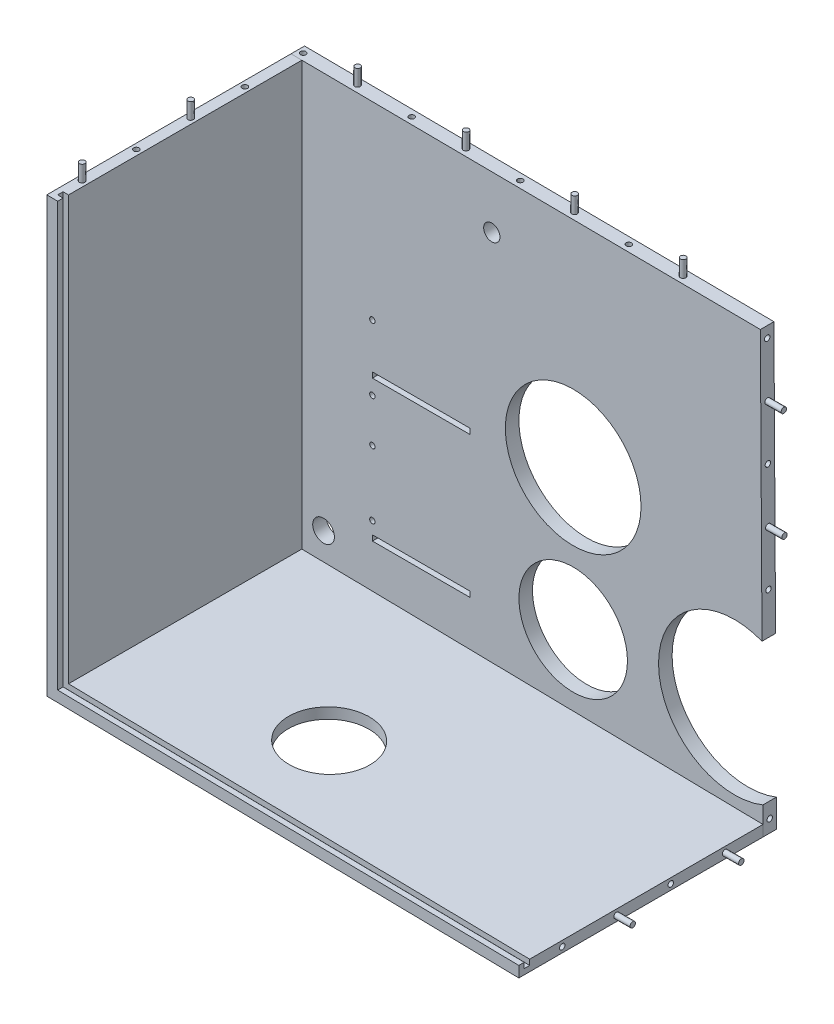
from build123d import *

# Parameters (mm, degrees)
SALIENTE_EXTRUIR1_DEPTH = 2.5
SALIENTE_EXTRUIR2_DEPTH = 45
CROQUIS17_R             = 12.5
CROQUIS17_R_2           = 10
CROQUIS17_R_3           = 2
CROQUIS17_R_4           = 0.5
CROQUIS17_R_5           = 1.5
CROQUIS17_W             = 18
CROQUIS17_H             = 1
CORTAR_EXTRUIR1_DEPTH   = 45
CROQUIS18_W             = 1
CROQUIS18_H             = 78.017022252
CORTAR_EXTRUIR2_DEPTH   = 1
CROQUIS19_W             = 1
CROQUIS19_H             = 1
CORTAR_EXTRUIR3_DEPTH   = 1
CROQUIS20_W             = 1
CROQUIS20_H             = 1
CORTAR_EXTRUIR4_DEPTH   = 1
CORTAR_EXTRUIR5_DEPTH   = 1
CROQUIS24_R             = 0.5
CORTAR_EXTRUIR13_DEPTH  = 4
CROQUIS25_R             = 0.5
SALIENTE_EXTRUIR3_DEPTH = 3
CROQUIS26_R             = 0.5
SALIENTE_EXTRUIR4_DEPTH = 3
CROQUIS27_R             = 0.5
CORTAR_EXTRUIR14_DEPTH  = 4
CROQUIS28_R             = 7.5
CORTAR_EXTRUIR15_DEPTH  = 45
CORTAR_EXTRUIR16_DEPTH  = 1
CROQUIS30_R             = 0.5
CORTAR_EXTRUIR17_DEPTH  = 4
CROQUIS31_R             = 0.5
SALIENTE_EXTRUIR5_DEPTH = 3
CROQUIS32_R             = 0.5
CORTAR_EXTRUIR18_DEPTH  = 4
CROQUIS33_R             = 0.5
SALIENTE_EXTRUIR6_DEPTH = 3


with BuildPart() as part:
    # Croquis15 → Saliente-Extruir1 (new body)
    with BuildSketch(Plane.XY):
        Polygon((0.493585448, -0.747010607), (-86, 0), (-86, -80), (0.987170897, -81.494021214), align=None)
    extrude(amount=SALIENTE_EXTRUIR1_DEPTH)

    # Croquis16 → Saliente-Extruir2 (add)
    with BuildSketch(Plane.XY.offset(2.5)):
        Polygon((-84, -0.017027708), (-84, -78.034055415), (0.974771701, -79.49351329), (0.987170897, -81.494021214), (-86, -80), (-86, 0), align=None)
    extrude(amount=SALIENTE_EXTRUIR2_DEPTH)

    # Croquis17 → Cortar-Extruir1 (cut)
    with BuildSketch(Plane.XY.offset(2.5)):
        with Locations((-34, -40)):
            Circle(CROQUIS17_R)
        with Locations((-34, -65.890897655)):
            Circle(CROQUIS17_R_2)
        with Locations((-80, -73.102018763)):
            Circle(CROQUIS17_R_3)
        with Locations((-71, -67)):
            Circle(CROQUIS17_R_4)
        with Locations((-71, -55)):
            Circle(CROQUIS17_R_4)
        with Locations((-71, -47)):
            Circle(CROQUIS17_R_4)
        with Locations((-71, -35)):
            Circle(CROQUIS17_R_4)
        with Locations((-49, -10)):
            Circle(CROQUIS17_R_5)
        with BuildLine():
            Line((0.796795552, -50.349991207), (0.955966786, -76.389254287))
            ThreePointArc((0.955966786, -76.389254287), (-18.269411222, -63.48665599), (0.796795552, -50.349991207))
        make_face()
        with Locations((-62, -43.756153027)):
            Rectangle(CROQUIS17_W, CROQUIS17_H)
        with Locations((-62, -69.756153027)):
            Rectangle(CROQUIS17_W, CROQUIS17_H)
    extrude(amount=-CORTAR_EXTRUIR1_DEPTH, mode=Mode.SUBTRACT)

    # Croquis18 → Cortar-Extruir2 (cut)
    with BuildSketch(Plane(origin=(-84, 0, 0), x_dir=(0, 0, -1), z_dir=(1, 0, 0))):
        with Locations((-46, -39.025544289)):
            Rectangle(CROQUIS18_W, CROQUIS18_H)
    extrude(amount=-CORTAR_EXTRUIR2_DEPTH, mode=Mode.SUBTRACT)

    # Croquis19 → Cortar-Extruir3 (cut)
    with BuildSketch(Plane(origin=(-0.006233319, -0.732138357, 0), x_dir=(0.9999637591169493, -0.008513545248592774, 0), z_dir=(0.008513545248592772, 0.9999637591169492, 0))):
        with Locations((-84.496810753, -46)):
            Rectangle(CROQUIS19_W, CROQUIS19_H)
    extrude(amount=-CORTAR_EXTRUIR3_DEPTH, mode=Mode.SUBTRACT)

    # Croquis20 → Cortar-Extruir4 (cut)
    with BuildSketch(Plane(origin=(0, -78.034055415, 0), x_dir=(1, 0, 0), z_dir=(0, 1, 0))):
        with Locations((-84.5, -46)):
            Rectangle(CROQUIS20_W, CROQUIS20_H)
    extrude(amount=-CORTAR_EXTRUIR4_DEPTH, mode=Mode.SUBTRACT)

    # Croquis21 → Cortar-Extruir5 (cut)
    with BuildSketch(Plane(origin=(-1.364626126, -79.453333687, 0), x_dir=(0.9998525390425657, -0.017172657631677066, 0), z_dir=(0.017172657631677066, 0.9998525390425657, 0))):
        Polygon((-82.647561162, -45.5), (2.339744744, -45.5), (2.893712102, -45.5), (2.893712102, -46.5), (2.339744744, -46.5), (-82.647561162, -46.5), align=None)
    extrude(amount=-CORTAR_EXTRUIR5_DEPTH, mode=Mode.SUBTRACT)

    # Croquis24 → Cortar-Extruir13 (cut)
    with BuildSketch(Plane(origin=(0.489000895, 0.002989135, 0), x_dir=(0, 0, -1), z_dir=(0.9999813177309185, 0.006112625388175005, 0))):
        with Locations(Location((-1.25, -79.193670629, 0), (0, 0, 90))):
            Circle(CROQUIS24_R)
        with Locations(Location((-1.25, -2.750013754, 0), (0, 0, 90))):
            Circle(CROQUIS24_R)
        with Locations(Location((-1.25, -22.750013754, 0), (0, 0, 90))):
            Circle(CROQUIS24_R)
        with Locations(Location((-1.25, -42.750013754, 0), (0, 0, 90))):
            Circle(CROQUIS24_R)
    extrude(amount=-CORTAR_EXTRUIR13_DEPTH, mode=Mode.SUBTRACT)

    # Croquis25 → Saliente-Extruir3 (add)
    with BuildSketch(Plane(origin=(0.489000895, 0.002989135, 0), x_dir=(0, 0, -1), z_dir=(0.9999813177309185, 0.006112625388175005, 0))):
        with Locations(Location((-1.25, -12.750013754, 0), (0, 0, 270))):
            Circle(CROQUIS25_R)
        with Locations(Location((-1.25, -32.750013754, 0), (0, 0, 270))):
            Circle(CROQUIS25_R)
    extrude(amount=SALIENTE_EXTRUIR3_DEPTH)

    # Croquis26 → Saliente-Extruir4 (add)
    with BuildSketch(Plane(origin=(0.482050481, 0.00298776, 0), x_dir=(0, 0, -1), z_dir=(0.9999807928027947, 0.006197904927802061, 0))):
        with Locations(Location((-29.5, -80.498301159, 0), (0, 0, 270))):
            Circle(CROQUIS26_R)
        with Locations(Location((-9.5, -80.498301159, 0), (0, 0, 270))):
            Circle(CROQUIS26_R)
    extrude(amount=SALIENTE_EXTRUIR4_DEPTH)

    # Croquis27 → Cortar-Extruir14 (cut)
    with BuildSketch(Plane(origin=(0.482050481, 0.00298776, 0), x_dir=(0, 0, -1), z_dir=(0.9999807928027947, 0.006197904927802061, 0))):
        with Locations(Location((-39.5, -80.498301159, 0), (0, 0, 90))):
            Circle(CROQUIS27_R)
        with Locations(Location((-19.5, -80.498301159, 0), (0, 0, 90))):
            Circle(CROQUIS27_R)
    extrude(amount=-CORTAR_EXTRUIR14_DEPTH, mode=Mode.SUBTRACT)

    # Croquis28 → Cortar-Extruir15 (cut)
    with BuildSketch(Plane(origin=(-1.398971441, -81.453038765, 0), x_dir=(0.9998525390425657, -0.017172657631677253, 0), z_dir=(-0.017172657631677253, -0.9998525390425657, 0))):
        with Locations((-50.113505747, 30)):
            Circle(CROQUIS28_R)
    extrude(amount=-CORTAR_EXTRUIR15_DEPTH, mode=Mode.SUBTRACT)

    # Croquis29 → Cortar-Extruir16 (cut)
    # profile 1 of 3: a face of its own
    with BuildSketch(Plane.ZY.offset(86)):
        with BuildLine():
            Line((35.52329541, -9.711538462), (35.52329541, -13.237179487))
            Line((35.52329541, -13.237179487), (20.429144769, -13.237179487))
            add(Edge.make_bspline(
                [(20.429144769, -13.237179487), (20.22047782, -13.236841737), (19.824837832, -13.23620135), (19.263896049, -13.240457868), (18.766476045, -13.252080365), (18.330708278, -13.260554583), (17.958236379, -13.273898403), (17.649661698, -13.296236406), (17.403575485, -13.312271777), (17.260662882, -13.33327988), (17.198976499, -13.342347756)],
                knots=[0, 0, 0, 0, 1.548615846, 2.93623095, 4.162984955, 5.241106349, 6.171018895, 6.928366462, 7.537443197, 8, 8, 8, 8], degree=3))
            add(Edge.make_bspline(
                [(17.198976499, -13.342347756), (16.96412934, -13.382077135), (16.513602756, -13.458293262), (15.879401974, -13.654086173), (15.320211591, -13.916571317), (14.819510023, -14.234178966), (14.386167329, -14.639811945), (13.992100598, -15.120178679), (13.642365687, -15.692786222), (13.340195558, -16.339291023), (13.090005597, -17.026900065), (12.901019793, -17.728129376), (12.78650359, -18.431694824), (12.773400723, -18.902503101), (12.766885153, -19.13661859)],
                knots=[0, 0, 0, 0, 1.067590609, 2.048046695, 2.965859215, 3.831907952, 4.695720383, 5.616094925, 6.611391988, 7.696587727, 8.812250663, 9.889278634, 10.950416576, 12, 12, 12, 12], degree=3))
            add(Edge.make_bspline(
                [(12.766885153, -19.13661859), (12.771984899, -19.354033868), (12.782116792, -19.785982571), (12.884189597, -20.423969754), (13.031967772, -21.050655641), (13.246142555, -21.656380321), (13.51653777, -22.227854792), (13.823959056, -22.760115625), (14.190892209, -23.233189992), (14.595330176, -23.66153837), (15.050100538, -24.037142647), (15.557209831, -24.349999074), (16.102651414, -24.626753304), (16.494244363, -24.758696274), (16.693167205, -24.825721154)],
                knots=[0, 0, 0, 0, 1.053587853, 2.093210329, 3.126064893, 4.1733194, 5.20188158, 6.189084004, 7.14768823, 8.09825903, 9.041562098, 9.998421197, 10.983230561, 12, 12, 12, 12], degree=3))
            add(Edge.make_bspline(
                [(16.693167205, -24.825721154), (16.778007387, -24.848727684), (16.964351604, -24.899259562), (17.279546355, -24.951579566), (17.655541864, -24.996027767), (18.093493353, -25.028355568), (18.590989912, -25.05806358), (19.14847833, -25.085705063), (19.7680829, -25.091593312), (20.202120744, -25.094587653), (20.429144769, -25.096153846)],
                knots=[0, 0, 0, 0, 0.561597947, 1.23350194, 2.039532505, 2.981504442, 4.039824342, 5.225453205, 6.548769908, 8, 8, 8, 8], degree=3))
            Line((20.429144769, -25.096153846), (35.52329541, -25.096153846))
            Line((35.52329541, -25.096153846), (35.52329541, -28.621794872))
            Line((35.52329541, -28.621794872), (20.479224897, -28.621794872))
            add(Edge.make_bspline(
                [(20.479224897, -28.621794872), (20.21375126, -28.620453864), (19.694242623, -28.617829629), (18.934447131, -28.58038573), (18.212556526, -28.527948127), (17.529078376, -28.448042871), (16.882841755, -28.342180266), (16.272707641, -28.21825022), (15.698637804, -28.073782209), (15.157290018, -27.903124304), (14.63991941, -27.699018156), (14.145396187, -27.438871772), (13.665559902, -27.132905857), (13.196849632, -26.781295749), (12.7459689, -26.376455058), (12.303788081, -25.927975482), (11.886299412, -25.421587843), (11.473265962, -24.882050562), (11.100725204, -24.294361259), (10.774191226, -23.671274939), (10.496894262, -23.016621485), (10.273579012, -22.330844799), (10.095746711, -21.613085652), (9.973729713, -20.864405333), (9.895727902, -20.083115391), (9.886815203, -19.552475038), (9.882269769, -19.281850962)],
                knots=[0, 0, 0, 0, 1.184156262, 2.317290007, 3.392772778, 4.412540671, 5.385841058, 6.313246062, 7.18923477, 8.02531694, 8.843971838, 9.66668118, 10.513702469, 11.380526931, 12.277256598, 13.214624232, 14.187183621, 15.202946586, 16.244160134, 17.286757567, 18.33793663, 19.411793888, 20.500906476, 21.633354837, 22.79302213, 24, 24, 24, 24], degree=3))
            add(Edge.make_bspline(
                [(9.882269769, -19.281850962), (9.887812324, -19.004635112), (9.898679014, -18.461127982), (9.962542537, -17.65951378), (10.078589861, -16.888661781), (10.237154038, -16.147021382), (10.444409043, -15.436225971), (10.693863718, -14.754501859), (10.990134404, -14.101619394), (11.32925914, -13.481705678), (11.70859858, -12.902952526), (12.119616123, -12.369599752), (12.563317193, -11.885173186), (13.036654256, -11.449844297), (13.543198032, -11.067277308), (14.074134589, -10.72730477), (14.642524512, -10.448001887), (15.037596556, -10.297749357), (15.235835474, -10.222355769)],
                knots=[0, 0, 0, 0, 1.183856505, 2.321059394, 3.431013839, 4.51040075, 5.557140175, 6.590049844, 7.607719453, 8.615832089, 9.604399492, 10.559715878, 11.48805571, 12.406324034, 13.301673357, 14.195574285, 15.094576781, 16, 16, 16, 16], degree=3))
            add(Edge.make_bspline(
                [(15.235835474, -10.222355769), (15.370526633, -10.180383198), (15.660336611, -10.090072371), (16.137751847, -9.987545784), (16.686939012, -9.906402917), (17.306037885, -9.828917183), (17.998041842, -9.777922297), (18.761002453, -9.735903387), (19.596085928, -9.719763974), (20.177076008, -9.714352661), (20.479224897, -9.711538462)],
                knots=[0, 0, 0, 0, 0.640185946, 1.377464392, 2.213439944, 3.159948418, 4.209014146, 5.362447644, 6.628318208, 8, 8, 8, 8], degree=3))
            Line((20.479224897, -9.711538462), (35.52329541, -9.711538462))
        make_face()
    # profile 2 of 3: a face of its own
    with BuildSketch(Plane.ZY.offset(86)):
        with BuildLine():
            Line((15.491244128, -33.108974359), (16.93355182, -36.073717949))
            add(Edge.make_bspline(
                [(16.93355182, -36.073717949), (16.604341133, -36.292254689), (15.973298144, -36.711153842), (15.12514, -37.394593222), (14.402460647, -38.07991585), (13.807792584, -38.773110115), (13.345018376, -39.477589426), (13.014020308, -40.190364126), (12.804987017, -40.913039728), (12.779507997, -41.400921361), (12.766885153, -41.642628205)],
                knots=[0, 0, 0, 0, 1.308492904, 2.508166676, 3.603367512, 4.603929388, 5.527362023, 6.386006977, 7.200393839, 8, 8, 8, 8], degree=3))
            add(Edge.make_bspline(
                [(12.766885153, -41.642628205), (12.773282512, -41.866777904), (12.785911096, -42.309256366), (12.896496373, -42.958558819), (13.064926057, -43.586612059), (13.30862936, -44.181536063), (13.612270105, -44.727532312), (13.957482055, -45.217367498), (14.356854325, -45.629336706), (14.793518192, -45.974431963), (15.264188247, -46.236541154), (15.747842838, -46.431891137), (16.245660999, -46.544763648), (16.580790417, -46.561933171), (16.748255346, -46.570512821)],
                knots=[0, 0, 0, 0, 1.147444368, 2.265090796, 3.364597228, 4.473012859, 5.548615949, 6.559594772, 7.533286176, 8.477543502, 9.40033763, 10.283242024, 11.142132155, 12, 12, 12, 12], degree=3))
            add(Edge.make_bspline(
                [(16.748255346, -46.570512821), (16.941510059, -46.5601087), (17.333769523, -46.538990899), (17.914805754, -46.354561728), (18.492268589, -46.066205141), (18.850326516, -45.801832193), (19.036917205, -45.6640625)],
                knots=[0, 0, 0, 0, 0.923016811, 1.873496762, 2.891839354, 4, 4, 4, 4], degree=3))
            add(Edge.make_bspline(
                [(19.036917205, -45.6640625), (19.173897703, -45.545751066), (19.465499953, -45.293891271), (19.88831965, -44.85556862), (20.34460738, -44.359070541), (20.810155088, -43.78628953), (21.304675701, -43.149320505), (21.809427554, -42.438375115), (22.345330245, -41.664238479), (22.699205045, -41.119416394), (22.883071051, -40.836338141)],
                knots=[0, 0, 0, 0, 0.701079612, 1.492448893, 2.357973608, 3.313818863, 4.351552843, 5.482583403, 6.692002559, 8, 8, 8, 8], degree=3))
            add(Edge.make_bspline(
                [(22.883071051, -40.836338141), (23.0710302, -40.547100657), (23.428776573, -39.99658922), (23.951215696, -39.215696064), (24.434509137, -38.523335658), (24.876588696, -37.912378329), (25.279997595, -37.387256665), (25.64378705, -36.947751297), (25.963789229, -36.588808831), (26.176953071, -36.392841044), (26.27349573, -36.304086538)],
                knots=[0, 0, 0, 0, 1.459386789, 2.777679801, 3.9747909, 5.031475051, 5.968066478, 6.775588314, 7.445459609, 8, 8, 8, 8], degree=3))
            add(Edge.make_bspline(
                [(26.27349573, -36.304086538), (26.42326634, -36.176164948), (26.715374768, -35.926670238), (27.182963531, -35.603972837), (27.657691289, -35.327623802), (28.143007367, -35.100338349), (28.639266653, -34.930417101), (29.142899142, -34.802880714), (29.658222737, -34.72619223), (30.005886019, -34.716423577), (30.17974573, -34.711538462)],
                knots=[0, 0, 0, 0, 1.094785085, 2.135238355, 3.154348872, 4.147069059, 5.11008593, 6.067042501, 7.033365187, 8, 8, 8, 8], degree=3))
            add(Edge.make_bspline(
                [(30.17974573, -34.711538462), (30.45437769, -34.723576168), (30.995664624, -34.747301932), (31.787484054, -34.921524578), (32.536901129, -35.215629697), (33.238243292, -35.626401781), (33.891905953, -36.129688565), (34.470533943, -36.738278135), (34.976782973, -37.436773401), (35.394156468, -38.222042042), (35.741429702, -39.062636252), (35.985664311, -39.948918758), (36.135371877, -40.867968719), (36.154586142, -41.491818892), (36.164321051, -41.807892628)],
                knots=[0, 0, 0, 0, 0.956321016, 1.884864637, 2.809319668, 3.749968513, 4.707367612, 5.673978092, 6.66510341, 7.703393335, 8.7650055, 9.827493431, 10.899299385, 12, 12, 12, 12], degree=3))
            add(Edge.make_bspline(
                [(36.164321051, -41.807892628), (36.155979802, -42.164146317), (36.139522311, -42.867043619), (35.970317242, -43.898474102), (35.713615109, -44.894502451), (35.39864941, -45.69167024), (35.09559751, -46.322362781), (34.810826209, -46.795145024), (34.491314869, -47.279947711), (34.116769737, -47.764449721), (33.700494415, -48.260349172), (33.241793492, -48.765631945), (32.73241304, -49.27213102), (32.372654522, -49.604834898), (32.187958871, -49.775641026)],
                knots=[0, 0, 0, 0, 1.390647473, 2.743781712, 4.072556592, 5.402339362, 6.084844723, 6.804035309, 7.556491126, 8.352162565, 9.194696725, 10.085687785, 11.017215372, 12, 12, 12, 12], degree=3))
            Line((32.187958871, -49.775641026), (30.395090282, -46.921073718))
            add(Edge.make_bspline(
                [(30.395090282, -46.921073718), (30.541610389, -46.772042125), (30.824031146, -46.484780423), (31.210937043, -46.050725339), (31.57014849, -45.651413885), (31.887610982, -45.273019352), (32.153802691, -44.909793733), (32.3956709, -44.582238687), (32.583854697, -44.269138579), (32.793375525, -43.890656157), (32.991022099, -43.414111779), (33.155078026, -42.825202543), (33.259402396, -42.213873067), (33.272873801, -41.798295414), (33.279705666, -41.587540064)],
                knots=[0, 0, 0, 0, 1.204145576, 2.32101731, 3.349958012, 4.29957675, 5.165343422, 5.944770912, 6.644297261, 7.268462246, 8.436881017, 9.606289352, 10.786057617, 12, 12, 12, 12], degree=3))
            add(Edge.make_bspline(
                [(33.279705666, -41.587540064), (33.270302467, -41.356399776), (33.252112312, -40.909267085), (33.106047361, -40.269028654), (32.856752616, -39.69235355), (32.515716907, -39.186685809), (32.100507121, -38.758442153), (31.598850271, -38.458381736), (31.037870361, -38.267522033), (30.640411715, -38.247512762), (30.435154384, -38.237179487)],
                knots=[0, 0, 0, 0, 1.126852983, 2.179857143, 3.182955932, 4.174582758, 5.142069895, 6.066719896, 7.001607042, 8, 8, 8, 8], degree=3))
            add(Edge.make_bspline(
                [(30.435154384, -38.237179487), (30.301371321, -38.2427065), (30.037254091, -38.253618041), (29.644754078, -38.319517462), (29.265075959, -38.43534724), (28.893665552, -38.598464076), (28.527258096, -38.813264153), (28.161988827, -39.085829488), (27.794832679, -39.417977806), (27.565000667, -39.672306689), (27.44537073, -39.8046875)],
                knots=[0, 0, 0, 0, 0.920334498, 1.816942984, 2.728642409, 3.64380564, 4.600865364, 5.643433543, 6.773382818, 8, 8, 8, 8], degree=3))
            add(Edge.make_bspline(
                [(27.44537073, -39.8046875), (27.391803983, -39.871341328), (27.268166524, -40.025185092), (27.060922763, -40.291357618), (26.816655952, -40.632974876), (26.535001548, -41.049085958), (26.200484491, -41.52935407), (25.832574496, -42.08543785), (25.421924843, -42.71253397), (25.133332829, -43.153374267), (24.981428423, -43.385416667)],
                knots=[0, 0, 0, 0, 0.471970771, 1.089356175, 1.861603393, 2.789307184, 3.862691175, 5.091845994, 6.469252835, 8, 8, 8, 8], degree=3))
            add(Edge.make_bspline(
                [(24.981428423, -43.385416667), (24.777913297, -43.698801235), (24.384971396, -44.303876303), (23.786434014, -45.160567605), (23.214019112, -45.944662246), (22.652626962, -46.643578555), (22.116624733, -47.269957918), (21.595990572, -47.817606906), (21.093082786, -48.288240206), (20.605408172, -48.685592806), (20.128099754, -49.021486997), (19.653531939, -49.306126183), (19.179568819, -49.547609606), (18.709978071, -49.751875158), (18.235563045, -49.900887922), (17.765175654, -50.010328376), (17.294976276, -50.087403266), (16.980596509, -50.093236601), (16.823375538, -50.096153846)],
                knots=[0, 0, 0, 0, 1.629268668, 3.145751097, 4.556504429, 5.861570416, 7.053779364, 8.150426075, 9.154768403, 10.055153352, 10.891214097, 11.697660615, 12.465950485, 13.209567891, 13.927813193, 14.630546386, 15.315137772, 16, 16, 16, 16], degree=3))
            add(Edge.make_bspline(
                [(16.823375538, -50.096153846), (16.599296343, -50.087575794), (16.153481778, -50.070509413), (15.494860428, -49.960360678), (14.857174863, -49.766069679), (14.240286524, -49.498473951), (13.638388615, -49.161644471), (13.061928193, -48.74137662), (12.504715924, -48.247425131), (11.974110356, -47.686879281), (11.485919823, -47.068835709), (11.053176758, -46.408591442), (10.691995548, -45.707694209), (10.39514188, -44.973444236), (10.164911535, -44.203749531), (9.998658444, -43.399732181), (9.904115364, -42.558015806), (9.889650849, -41.985074075), (9.882269769, -41.692708333)],
                knots=[0, 0, 0, 0, 0.890970815, 1.772622245, 2.646116451, 3.535057773, 4.441469474, 5.382785186, 6.365564227, 7.398456961, 8.447473419, 9.49312494, 10.532119894, 11.577286814, 12.637684961, 13.721991897, 14.837558004, 16, 16, 16, 16], degree=3))
            add(Edge.make_bspline(
                [(9.882269769, -41.692708333), (9.886422137, -41.478918338), (9.894610938, -41.057307418), (9.950665699, -40.431566134), (10.044482211, -39.822302474), (10.181118667, -39.226772767), (10.356286891, -38.64831623), (10.566416361, -38.083477465), (10.819072437, -37.537890855), (11.105058389, -37.001409924), (11.441580228, -36.474888884), (11.846261778, -35.967043297), (12.302782586, -35.461324583), (12.828043643, -34.974773859), (13.401865374, -34.485920137), (14.044301964, -34.015883533), (14.742515577, -33.550731931), (15.237724733, -33.258553419), (15.491244128, -33.108974359)],
                knots=[0, 0, 0, 0, 0.947558504, 1.86866093, 2.782243539, 3.677912211, 4.574436229, 5.459497986, 6.34681468, 7.237334027, 8.152712672, 9.111871318, 10.112295277, 11.169628743, 12.282807129, 13.451902375, 14.695516508, 16, 16, 16, 16], degree=3))
        make_face()
    # profile 3 of 3: a face of its own
    with BuildSketch(Plane.ZY.offset(86)):
        with BuildLine():
            Line((35.52329541, -55.544871795), (35.52329541, -61.233974359))
            add(Edge.make_bspline(
                [(35.52329541, -61.233974359), (35.521870573, -61.509456417), (35.51909736, -62.045637168), (35.483312249, -62.827359918), (35.425236438, -63.562616773), (35.338650932, -64.250561768), (35.235958678, -64.892918448), (35.106433637, -65.490053194), (34.951819162, -66.040061294), (34.721596059, -66.703107984), (34.367914748, -67.456193427), (33.846096126, -68.265480543), (33.225781109, -68.969025599), (32.518148232, -69.556483968), (31.747452735, -70.02075152), (30.941605185, -70.364182312), (30.101797993, -70.572644145), (29.529844314, -70.596846793), (29.243247333, -70.608974359)],
                knots=[0, 0, 0, 0, 1.042414825, 2.028889893, 2.960607523, 3.832701716, 4.652113621, 5.421594411, 6.143554098, 6.812849602, 8.076068791, 9.281578892, 10.445179295, 11.611520164, 12.748002105, 13.837971116, 14.916641374, 16, 16, 16, 16], degree=3))
            add(Edge.make_bspline(
                [(29.243247333, -70.608974359), (28.975228547, -70.598798775), (28.444006707, -70.578630441), (27.664264223, -70.403812007), (26.911494004, -70.133735406), (26.199843781, -69.754187173), (25.549054065, -69.282002867), (24.985112151, -68.720153016), (24.520941828, -68.073524883), (24.30102515, -67.59166807), (24.190162397, -67.348758013)],
                knots=[0, 0, 0, 0, 1.007875899, 1.997642401, 2.993614146, 4.011316746, 5.023181615, 6.009690753, 6.996660169, 8, 8, 8, 8], degree=3))
            add(Edge.make_bspline(
                [(24.190162397, -67.348758013), (24.106697517, -67.640824562), (23.94458387, -68.208104761), (23.625176441, -69.009710203), (23.236696656, -69.729739781), (22.795379329, -70.374914632), (22.30119819, -70.94436039), (21.763180283, -71.442320377), (21.183391758, -71.873019141), (20.562082571, -72.226857986), (19.913047988, -72.50974608), (19.237658146, -72.70424651), (18.54417573, -72.83032228), (18.072587313, -72.845112548), (17.834994128, -72.852564103)],
                knots=[0, 0, 0, 0, 1.202781609, 2.336160008, 3.410129986, 4.437275258, 5.426359587, 6.390301084, 7.335923732, 8.280783101, 9.216784981, 10.133290094, 11.059524077, 12, 12, 12, 12], degree=3))
            add(Edge.make_bspline(
                [(17.834994128, -72.852564103), (17.590782235, -72.844953146), (17.106041405, -72.829846015), (16.393131343, -72.706310942), (15.705731409, -72.505022302), (15.045278711, -72.222039258), (14.411069361, -71.857996195), (13.802334525, -71.415629687), (13.225332201, -70.886925139), (12.670654408, -70.292550721), (12.169510729, -69.623230809), (11.722909542, -68.898217562), (11.353468289, -68.110635392), (11.048052849, -67.26926139), (10.813390272, -66.370275588), (10.643841692, -65.417646409), (10.543610608, -64.4078603), (10.530176608, -63.716506733), (10.52329541, -63.362379808)],
                knots=[0, 0, 0, 0, 0.877238839, 1.741248059, 2.591737276, 3.446469204, 4.317118362, 5.214738423, 6.14496826, 7.125677697, 8.132394207, 9.144868473, 10.180748733, 11.253046613, 12.357554971, 13.515564447, 14.727415947, 16, 16, 16, 16], degree=3))
            Line((10.52329541, -63.362379808), (10.52329541, -55.544871795))
            Line((10.52329541, -55.544871795), (35.52329541, -55.544871795))
        make_face()
        with BuildLine():
            Line((32.638680025, -59.070512821), (25.266885153, -59.070512821))
            Line((25.266885153, -59.070512821), (25.266885153, -60.052083333))
            add(Edge.make_bspline(
                [(25.266885153, -60.052083333), (25.266722725, -60.285829583), (25.266410521, -60.735112531), (25.295329732, -61.384459791), (25.327127994, -61.984227913), (25.377744767, -62.537040864), (25.439897075, -63.040439697), (25.522902191, -63.494051735), (25.607322163, -63.900982432), (25.754280632, -64.365907623), (25.970508421, -64.887524562), (26.295479021, -65.446750316), (26.685859586, -65.93588743), (27.135727721, -66.346354914), (27.632253058, -66.672266588), (28.158242544, -66.912080931), (28.712802566, -67.059166777), (29.092129894, -67.07523495), (29.283311435, -67.083333333)],
                knots=[0, 0, 0, 0, 1.232376453, 2.368746992, 3.426838363, 4.399102334, 5.295485424, 6.100128897, 6.830521304, 7.484811508, 8.668407512, 9.800679563, 10.88395505, 11.955688981, 12.998177292, 14.002777221, 14.993396725, 16, 16, 16, 16], degree=3))
            add(Edge.make_bspline(
                [(29.283311435, -67.083333333), (29.408787322, -67.079694836), (29.656208301, -67.072520224), (30.015249799, -67.009855896), (30.358317266, -66.916355212), (30.676671917, -66.774527582), (30.977234703, -66.598058039), (31.2524589, -66.379909833), (31.5121683, -66.12717707), (31.748091572, -65.829663154), (31.957958927, -65.485981702), (32.145987556, -65.096364705), (32.298758436, -64.653856866), (32.421621831, -64.160614751), (32.522207887, -63.618943807), (32.590567707, -63.026664533), (32.629480307, -62.384676263), (32.635539253, -61.940159452), (32.638680025, -61.709735577)],
                knots=[0, 0, 0, 0, 0.841763272, 1.659839986, 2.44035775, 3.223285766, 3.992129155, 4.774575714, 5.575035622, 6.420446936, 7.316212529, 8.273657565, 9.319331567, 10.452849805, 11.683848484, 13.015618618, 14.452988271, 16, 16, 16, 16], degree=3))
            Line((32.638680025, -61.709735577), (32.638680025, -59.070512821))
        make_face(mode=Mode.SUBTRACT)
        with BuildLine():
            Line((22.382269769, -59.070512821), (13.407910794, -59.070512821))
            Line((13.407910794, -59.070512821), (13.407910794, -61.925080128))
            add(Edge.make_bspline(
                [(13.407910794, -61.925080128), (13.410682107, -62.170476268), (13.416018227, -62.642982728), (13.43285934, -63.326176296), (13.473547451, -63.955774766), (13.528501734, -64.533611505), (13.595110735, -65.060844498), (13.687848614, -65.53432331), (13.782445179, -65.958173217), (13.944642369, -66.442320783), (14.183774045, -66.98643695), (14.550297833, -67.568479948), (14.977400039, -68.086845153), (15.473057038, -68.523686923), (16.009707454, -68.883576607), (16.582615759, -69.13207394), (17.171106399, -69.30027315), (17.573441646, -69.318031273), (17.774897974, -69.326923077)],
                knots=[0, 0, 0, 0, 1.220518499, 2.350089437, 3.398257681, 4.357354388, 5.23678711, 6.039516972, 6.756385954, 7.394350861, 8.576165671, 9.702589783, 10.804891994, 11.904564902, 12.977590492, 14.003460037, 15.000297356, 16, 16, 16, 16], degree=3))
            add(Edge.make_bspline(
                [(17.774897974, -69.326923077), (17.901898122, -69.322297361), (18.15185431, -69.313193226), (18.521781716, -69.264136533), (18.877261453, -69.172959313), (19.220953751, -69.046456901), (19.552976944, -68.885191139), (19.874502394, -68.688451893), (20.185464299, -68.458165288), (20.584022461, -68.09882265), (21.037144485, -67.565462247), (21.490150042, -66.815504547), (21.847163073, -65.949720838), (22.001577736, -65.324679841), (22.081788999, -65)],
                knots=[0, 0, 0, 0, 0.690115964, 1.358256341, 2.022446842, 2.679417667, 3.344536025, 4.024146413, 4.724199423, 5.443372001, 6.935424174, 8.506139117, 10.185101139, 12, 12, 12, 12], degree=3))
            add(Edge.make_bspline(
                [(22.081788999, -65), (22.106532134, -64.870007904), (22.159934189, -64.589451483), (22.215084247, -64.132477419), (22.27417688, -63.610495777), (22.307966062, -63.021959011), (22.347793214, -62.367899626), (22.362380626, -61.647989153), (22.380337134, -60.861799705), (22.381608741, -60.315853836), (22.382269769, -60.032051282)],
                knots=[0, 0, 0, 0, 0.6370545, 1.374927673, 2.215637013, 3.16640506, 4.212976324, 5.371024817, 6.633362916, 8, 8, 8, 8], degree=3))
            Line((22.382269769, -60.032051282), (22.382269769, -59.070512821))
        make_face(mode=Mode.SUBTRACT)
    extrude(amount=-CORTAR_EXTRUIR16_DEPTH, mode=Mode.SUBTRACT)

    # Croquis30 → Cortar-Extruir17 (cut)
    with BuildSketch(Plane(origin=(-0.006414337, -0.742692308, 0), x_dir=(0.9999627066458414, -0.008636279148040542, 0), z_dir=(0.008636279148040542, 0.9999627066458414, 0))):
        with Locations(Location((-84.996792772, -1.25, 0), (0, 0, 180))):
            Circle(CROQUIS30_R)
        with Locations(Location((-64.996792772, -1.25, 0), (0, 0, 180))):
            Circle(CROQUIS30_R)
        with Locations(Location((-44.996792772, -1.25, 0), (0, 0, 180))):
            Circle(CROQUIS30_R)
        with Locations(Location((-24.996792772, -1.25, 0), (0, 0, 180))):
            Circle(CROQUIS30_R)
    extrude(amount=-CORTAR_EXTRUIR17_DEPTH, mode=Mode.SUBTRACT)

    # Croquis31 → Saliente-Extruir5 (add)
    with BuildSketch(Plane(origin=(-0.006414337, -0.742692308, 0), x_dir=(0.9999627066458414, -0.008636279148040542, 0), z_dir=(0.008636279148040542, 0.9999627066458414, 0))):
        with Locations((-74.996792772, -1.25)):
            Circle(CROQUIS31_R)
        with Locations((-54.996792772, -1.25)):
            Circle(CROQUIS31_R)
        with Locations((-34.996792772, -1.25)):
            Circle(CROQUIS31_R)
        with Locations((-14.996792772, -1.25)):
            Circle(CROQUIS31_R)
    extrude(amount=SALIENTE_EXTRUIR5_DEPTH)

    # Croquis32 → Cortar-Extruir18 (cut)
    with BuildSketch(Plane(origin=(-0.006233319, -0.732138357, 0), x_dir=(0.9999637591169493, -0.008513545248592774, 0), z_dir=(0.008513545248592772, 0.9999637591169492, 0))):
        with Locations(Location((-84.996847042, -12, 0), (0, 0, 180))):
            Circle(CROQUIS32_R)
        with Locations(Location((-84.996847042, -32, 0), (0, 0, 180))):
            Circle(CROQUIS32_R)
    extrude(amount=-CORTAR_EXTRUIR18_DEPTH, mode=Mode.SUBTRACT)

    # Croquis33 → Saliente-Extruir6 (add)
    with BuildSketch(Plane(origin=(-0.006233319, -0.732138357, 0), x_dir=(0.9999637591169493, -0.008513545248592774, 0), z_dir=(0.008513545248592772, 0.9999637591169492, 0))):
        with Locations((-84.996847042, -22)):
            Circle(CROQUIS33_R)
        with Locations((-84.996847042, -42)):
            Circle(CROQUIS33_R)
    extrude(amount=SALIENTE_EXTRUIR6_DEPTH)


solid = part.part
